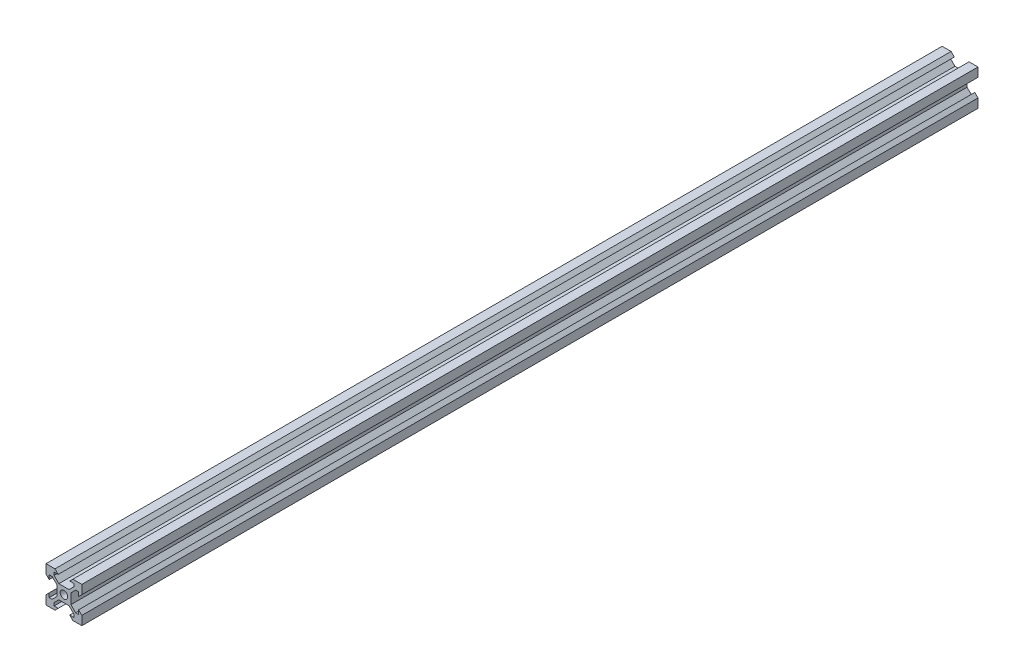
from build123d import *

# Parameters (mm, degrees)
SKETCH1_R           = 2.1
BOSS_EXTRUDE1_DEPTH = 250


with BuildPart() as part:
    # Sketch1 → Boss-Extrude1 (new, symmetric)
    with BuildSketch(Plane.XY):
        Polygon((-10, 10), (-5, 10), (-3.2, 8.2), (-5.499339828, 8.2), (-5.499339828, 6.56), (-2.84, 3.900660172), (2.84, 3.900660172), (5.499339828, 6.56), (5.499339828, 8.2), (3.2, 8.2), (5, 10), (10, 10), (10, 5), (8.2, 3.2), (8.2, 5.499339828), (6.56, 5.499339828), (3.900660172, 2.84), (3.900660172, -2.84), (6.56, -5.499339828), (8.2, -5.499339828), (8.2, -3.2), (10, -5), (10, -10), (5, -10), (3.2, -8.2), (5.499339828, -8.2), (5.499339828, -6.56), (2.84, -3.900660172), (-2.84, -3.900660172), (-5.499339828, -6.56), (-5.499339828, -8.2), (-3.2, -8.2), (-5, -10), (-10, -10), (-10, -5), (-8.2, -3.2), (-8.2, -5.499339828), (-6.56, -5.499339828), (-3.900660172, -2.84), (-3.900660172, 2.84), (-6.56, 5.499339828), (-8.2, 5.499339828), (-8.2, 3.2), (-10, 5), align=None)
        Circle(SKETCH1_R, mode=Mode.SUBTRACT)
    extrude(amount=BOSS_EXTRUDE1_DEPTH, both=True)


solid = part.part
